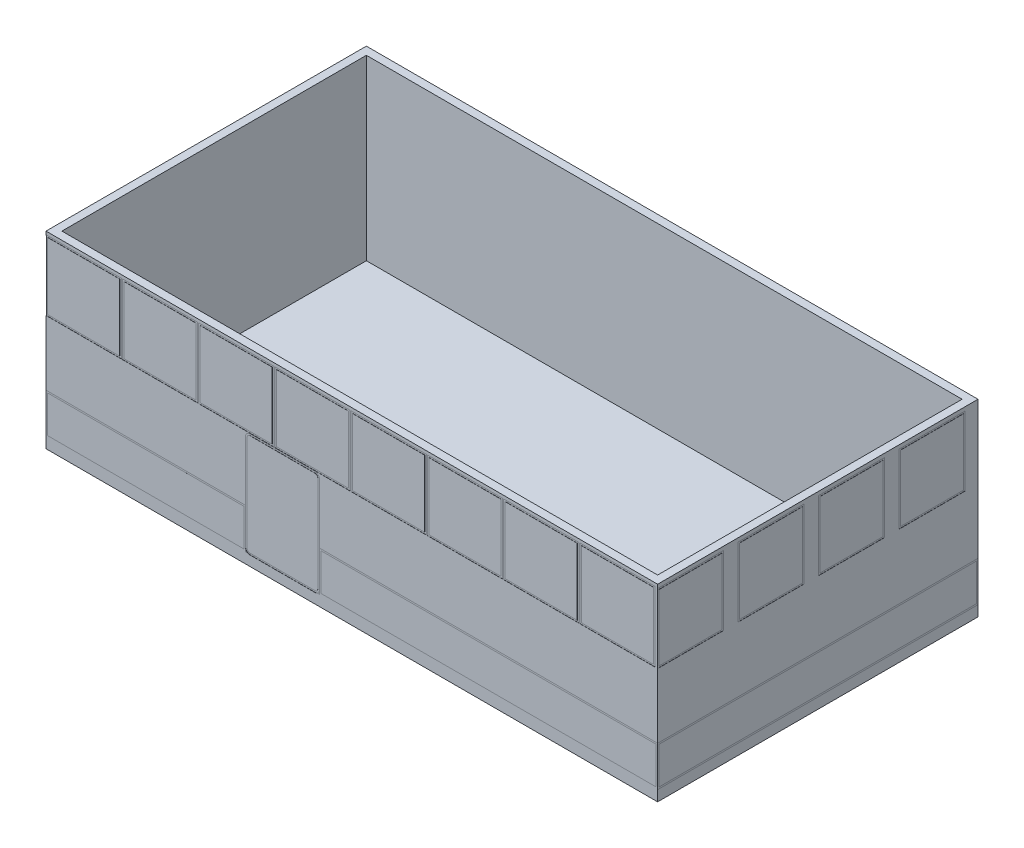
from build123d import *

# Parameters (mm, degrees)
CROQUIS1_W              = 11550
CROQUIS1_H              = 6050
CROQUIS1_W_2            = 11250
CROQUIS1_H_2            = 5750
SALIENTE_EXTRUIR1_DEPTH = 3360
CROQUIS2_W              = 11550
CROQUIS2_H              = 6050
SALIENTE_EXTRUIR2_DEPTH = 200
CROQUIS3_W              = 1421.245135369
CROQUIS3_H              = 1320.863661001
CROQUIS3_W_2            = 1361.245135369
CROQUIS3_H_2            = 1260.863661001
CORTAR_EXTRUIR1_DEPTH   = 3
MATRIZL1_COUNT          = 8
MATRIZL1_PITCH          = 1440
CROQUIS4_W              = 1244.178474792
CROQUIS4_H              = 1309.36156982
CROQUIS4_W_2            = 1184.178474792
CROQUIS4_H_2            = 1249.36156982
CORTAR_EXTRUIR2_DEPTH   = 3
MATRIZL2_COUNT          = 4
MATRIZL2_PITCH          = 1520
CROQUIS5_W              = 1244.178474792
CROQUIS5_H              = 1309.36156982
CROQUIS5_W_2            = 1184.178474792
CROQUIS5_H_2            = 1249.36156982
CORTAR_EXTRUIR3_DEPTH   = 3
MATRIZL3_COUNT          = 4
MATRIZL3_PITCH          = 1520
CORTAR_EXTRUIR4_DEPTH   = 3
CROQUIS7_W              = 11550
CROQUIS7_H              = 200
CORTAR_EXTRUIR5_DEPTH   = 0.011
CORTAR_EXTRUIR6_DEPTH   = 0.011
CROQUIS9_W              = 11549.989
CROQUIS9_H              = 200
CORTAR_EXTRUIR7_DEPTH   = 0.011
CORTAR_EXTRUIR8_DEPTH   = 0.011
CROQUIS11_W             = 1421.245135369
CROQUIS11_H             = 1320.863661001
CROQUIS11_W_2           = 1361.245135369
CROQUIS11_H_2           = 1260.863661001
CORTAR_EXTRUIR9_DEPTH   = 0.011
MATRIZL4_COUNT          = 8
MATRIZL4_PITCH          = 1440
CORTAR_EXTRUIR10_DEPTH  = 0.011
CROQUIS13_W             = 3764.70657803
CROQUIS13_H             = 758.52635577
CROQUIS13_W_2           = 3704.70657803
CROQUIS13_H_2           = 698.52635577
CROQUIS13_W_3           = 6385.29342197
CROQUIS13_W_4           = 6325.29342197
CORTAR_EXTRUIR13_DEPTH  = 0.011
CORTAR_EXTRUIR14_DEPTH  = 0.0011
SALIENTE_EXTRUIR3_DEPTH = 0.0011


with BuildPart() as part:
    # Croquis1 → Saliente-Extruir1 (new body)
    with BuildSketch(Plane(origin=(0, 0, 0), x_dir=(1, 0, 0), z_dir=(0, 1, 0))):
        Rectangle(CROQUIS1_W, CROQUIS1_H)
        Rectangle(CROQUIS1_W_2, CROQUIS1_H_2, mode=Mode.SUBTRACT)
    extrude(amount=SALIENTE_EXTRUIR1_DEPTH)

    # Croquis2 → Saliente-Extruir2 (add)
    with BuildSketch(Plane.XZ):
        Rectangle(CROQUIS2_W, CROQUIS2_H)
    extrude(amount=SALIENTE_EXTRUIR2_DEPTH)

    # Croquis3 → Cortar-Extruir1 (cut)
    with BuildSketch(Plane.XY.offset(3025)):
        with Locations((-5064.377432316, 2640.431830501)):
            Rectangle(CROQUIS3_W, CROQUIS3_H)
        with Locations((-5064.377432316, 2640.431830501)):
            Rectangle(CROQUIS3_W_2, CROQUIS3_H_2, mode=Mode.SUBTRACT)
    cortar_extruir1 = extrude(amount=-CORTAR_EXTRUIR1_DEPTH, mode=Mode.SUBTRACT)

    # MatrizL1: Cortar-Extruir1 ×8
    with Locations(*[(i * MATRIZL1_PITCH, 0, 0) for i in range(1, MATRIZL1_COUNT)]):
        add(cortar_extruir1, mode=Mode.SUBTRACT)

    # Croquis4 → Cortar-Extruir2 (cut)
    with BuildSketch(Plane(origin=(5775, 0, 0), x_dir=(0, 0, -1), z_dir=(1, 0, 0))):
        with Locations((-2402.910762604, 2634.68078491)):
            Rectangle(CROQUIS4_W, CROQUIS4_H)
        with Locations((-2402.910762604, 2634.68078491)):
            Rectangle(CROQUIS4_W_2, CROQUIS4_H_2, mode=Mode.SUBTRACT)
    cortar_extruir2 = extrude(amount=-CORTAR_EXTRUIR2_DEPTH, mode=Mode.SUBTRACT)

    # MatrizL2: Cortar-Extruir2 ×4
    with Locations(*[(0, 0, -i * MATRIZL2_PITCH) for i in range(1, MATRIZL2_COUNT)]):
        add(cortar_extruir2, mode=Mode.SUBTRACT)

    # Croquis5 → Cortar-Extruir3 (cut)
    with BuildSketch(Plane.ZY.offset(5775)):
        with Locations((2402.910762604, 2634.68078491)):
            Rectangle(CROQUIS5_W, CROQUIS5_H)
        with Locations((2402.910762604, 2634.68078491)):
            Rectangle(CROQUIS5_W_2, CROQUIS5_H_2, mode=Mode.SUBTRACT)
    cortar_extruir3 = extrude(amount=-CORTAR_EXTRUIR3_DEPTH, mode=Mode.SUBTRACT)

    # MatrizL3: Cortar-Extruir3 ×4
    with Locations(*[(0, 0, -i * MATRIZL3_PITCH) for i in range(1, MATRIZL3_COUNT)]):
        add(cortar_extruir3, mode=Mode.SUBTRACT)

    # Croquis6 → Cortar-Extruir4 (cut)
    with BuildSketch(Plane.XY.offset(3025)):
        with BuildLine():
            Line((-1920.29342197, 1969.318267569), (-700.29342197, 1969.318267569))
            ThreePointArc((-700.29342197, 1969.318267569), (-636.653811663, 1942.957877875), (-610.29342197, 1879.318267569))
            Line((-610.29342197, 1879.318267569), (-610.29342197, 79.318267569))
            ThreePointArc((-610.29342197, 79.318267569), (-636.653811663, 15.678657262), (-700.29342197, -10.681732431))
            Line((-700.29342197, -10.681732431), (-1920.29342197, -10.681732431))
            ThreePointArc((-1920.29342197, -10.681732431), (-1983.933032277, 15.678657262), (-2010.29342197, 79.318267569))
            Line((-2010.29342197, 79.318267569), (-2010.29342197, 1879.318267569))
            ThreePointArc((-2010.29342197, 1879.318267569), (-1983.933032277, 1942.957877875), (-1920.29342197, 1969.318267569))
        make_face()
        with BuildLine():
            ThreePointArc((-1920.29342197, 1939.318267569), (-1962.719828841, 1921.74467444), (-1980.29342197, 1879.318267569))
            Line((-1980.29342197, 1879.318267569), (-1980.29342197, 79.318267569))
            ThreePointArc((-1980.29342197, 79.318267569), (-1962.719828841, 36.891860698), (-1920.29342197, 19.318267569))
            Line((-1920.29342197, 19.318267569), (-700.29342197, 19.318267569))
            ThreePointArc((-700.29342197, 19.318267569), (-657.867015099, 36.891860698), (-640.29342197, 79.318267569))
            Line((-640.29342197, 79.318267569), (-640.29342197, 1879.318267569))
            ThreePointArc((-640.29342197, 1879.318267569), (-657.867015099, 1921.74467444), (-700.29342197, 1939.318267569))
            Line((-700.29342197, 1939.318267569), (-1920.29342197, 1939.318267569))
        make_face(mode=Mode.SUBTRACT)
    extrude(amount=-CORTAR_EXTRUIR4_DEPTH, mode=Mode.SUBTRACT)

    # Croquis7 → Cortar-Extruir5 (cut)
    with BuildSketch(Plane.XY.offset(3025)):
        with Locations((0, -100)):
            Rectangle(CROQUIS7_W, CROQUIS7_H)
    extrude(amount=-CORTAR_EXTRUIR5_DEPTH, mode=Mode.SUBTRACT)

    # Croquis8 → Cortar-Extruir6 (cut)
    with BuildSketch(Plane(origin=(5775, 0, 0), x_dir=(0, 0, -1), z_dir=(1, 0, 0))):
        Polygon((-3024.989, -200), (-3025, 0), (3025, 0), (3025, -200), align=None)
    extrude(amount=-CORTAR_EXTRUIR6_DEPTH, mode=Mode.SUBTRACT)

    # Croquis9 → Cortar-Extruir7 (cut)
    with BuildSketch(Plane(origin=(0, 0, -3025), x_dir=(-1, 0, 0), z_dir=(0, 0, -1))):
        with Locations((0.0055, -100)):
            Rectangle(CROQUIS9_W, CROQUIS9_H)
    extrude(amount=-CORTAR_EXTRUIR7_DEPTH, mode=Mode.SUBTRACT)

    # Croquis10 → Cortar-Extruir8 (cut)
    with BuildSketch(Plane.ZY.offset(5775)):
        Polygon((-3024.989, -200), (-3024.989, 0), (3024.989, -10.681732431), (3024.989, -200), align=None)
    extrude(amount=-CORTAR_EXTRUIR8_DEPTH, mode=Mode.SUBTRACT)

    # Croquis11 → Cortar-Extruir9 (cut)
    with BuildSketch(Plane(origin=(0, 0, -3025), x_dir=(-1, 0, 0), z_dir=(0, 0, -1))):
        with Locations((5064.377432316, 2640.431830501)):
            Rectangle(CROQUIS11_W, CROQUIS11_H)
        with Locations((5064.377432316, 2640.431830501)):
            Rectangle(CROQUIS11_W_2, CROQUIS11_H_2, mode=Mode.SUBTRACT)
    cortar_extruir9 = extrude(amount=-CORTAR_EXTRUIR9_DEPTH, mode=Mode.SUBTRACT)

    # MatrizL4: Cortar-Extruir9 ×8
    with Locations(*[(i * MATRIZL4_PITCH, 0, 0) for i in range(1, MATRIZL4_COUNT)]):
        add(cortar_extruir9, mode=Mode.SUBTRACT)

    # Croquis12 → Cortar-Extruir10 (cut)
    with BuildSketch(Plane.ZY.offset(5775)):
        Polygon((-2087.82675758, -1.654636813), (-2087.82675758, 1954.119709372), (1430.849882809, 1954.119709372), (1430.849882809, -7.867149055), align=None)
        Polygon((-2057.82675758, 28.292442485), (-2057.82675758, 1924.119709372), (1400.849882809, 1924.119709372), (1400.849882809, 22.185865165), align=None, mode=Mode.SUBTRACT)
    extrude(amount=-CORTAR_EXTRUIR10_DEPTH, mode=Mode.SUBTRACT)

    # Croquis13 → Cortar-Extruir13 (cut)
    # profile 1 of 2: a face of its own
    with BuildSketch(Plane.XY.offset(3025)):
        with Locations((-3892.646710985, 379.263177885)):
            Rectangle(CROQUIS13_W, CROQUIS13_H)
        with Locations((-3892.646710985, 379.263177885)):
            Rectangle(CROQUIS13_W_2, CROQUIS13_H_2, mode=Mode.SUBTRACT)
    # profile 2 of 2: a face of its own
    with BuildSketch(Plane.XY.offset(3025)):
        with Locations((2582.353289015, 379.263177885)):
            Rectangle(CROQUIS13_W_3, CROQUIS13_H)
        with Locations((2582.353289015, 379.263177885)):
            Rectangle(CROQUIS13_W_4, CROQUIS13_H_2, mode=Mode.SUBTRACT)
    extrude(amount=-CORTAR_EXTRUIR13_DEPTH, mode=Mode.SUBTRACT)

    # Croquis14 → Cortar-Extruir14 (cut)
    with BuildSketch(Plane(origin=(5775, 0, 0), x_dir=(0, 0, -1), z_dir=(1, 0, 0))):
        Polygon((-3024.989, 758.52635577), (3025, 758.52635577), (3024.989, 0), (-3024.989, 0), align=None)
        Polygon((-2994.989, 30), (-2994.989, 728.52635577), (2994.999564943, 728.52635577), (2994.989435051, 30), align=None, mode=Mode.SUBTRACT)
    extrude(amount=-CORTAR_EXTRUIR14_DEPTH, mode=Mode.SUBTRACT)

    # Croquis16 → Saliente-Extruir3 (add)
    with BuildSketch(Plane(origin=(0, 0, -3025), x_dir=(-1, 0, 0), z_dir=(0, 0, -1))):
        Polygon((-5775, 0), (5774.989, 0), (5775, 758.52635577), (-5774.99945, 758.52635577), align=None)
    extrude(amount=SALIENTE_EXTRUIR3_DEPTH)


solid = part.part
